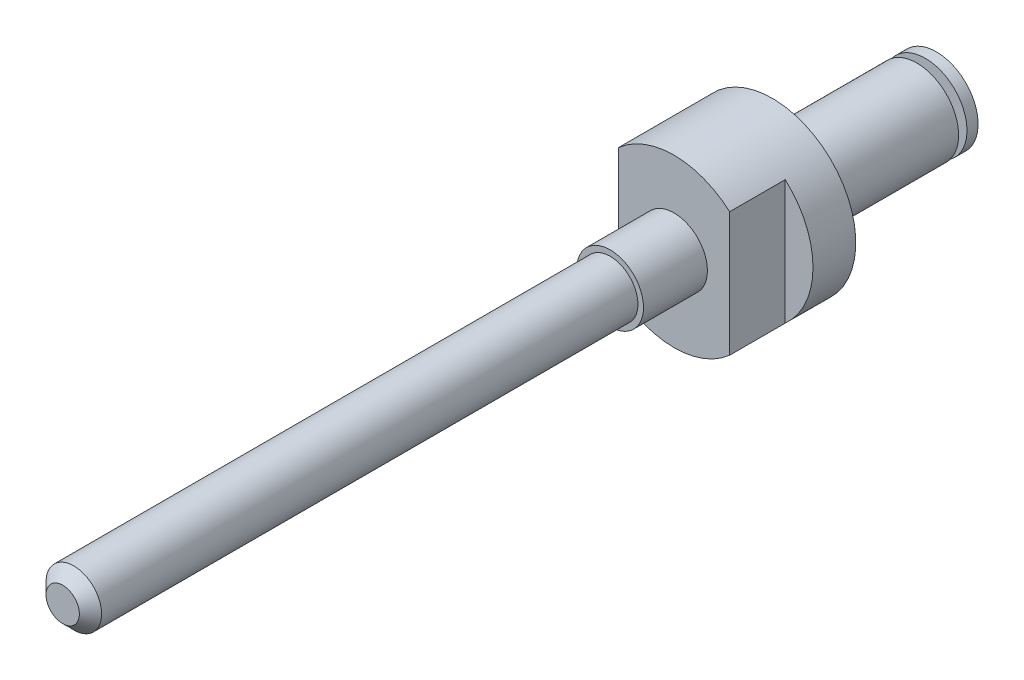
from build123d import *

# Parameters (mm, degrees)
SKETCH2_W           = 1
SKETCH2_H           = 3
CUT_EXTRUDE1_DEPTH  = 1
SKETCH3_R           = 0.6
BOSS_EXTRUDE1_DEPTH = 11
CUT_EXTRUDE2_START  = 1.15
SKETCH4_R           = 0.6
SKETCH4_R_2         = 0.5
CUT_EXTRUDE2_DEPTH  = 11.052678251
CHAMFER1_SIZE       = 0.2


with BuildPart() as part:
    # Sketch1 → Revolve1 (revolve)
    with BuildSketch(Plane(origin=(0, 0, 0), x_dir=(1, 0, 0), z_dir=(0, 1, 0))):
        Polygon((0, 0), (-1.5, 0), (-1.5, 1.77), (-0.75, 1.77), (-0.75, 4.37), (-0.5, 4.37), (-0.5, 4.52), (-0.75, 4.52), (-0.75, 4.72), (0, 4.72), align=None)
    revolve(axis=Axis((0, 0, -4.72), (0, 0, 1)))

    # Sketch2 → Cut-Extrude1 (cut)
    with BuildSketch(Plane.XY):
        with Locations((-1.5, 0)):
            Rectangle(SKETCH2_W, SKETCH2_H)
        with Locations((1.5, 0)):
            Rectangle(SKETCH2_W, SKETCH2_H)
    extrude(amount=-CUT_EXTRUDE1_DEPTH, mode=Mode.SUBTRACT)

    # Sketch3 → Boss-Extrude1 (add)
    with BuildSketch(Plane.XY):
        Circle(SKETCH3_R)
    extrude(amount=BOSS_EXTRUDE1_DEPTH)

    # Sketch4 → Cut-Extrude2 (cut, through all)
    with BuildSketch(Plane.XY.offset(CUT_EXTRUDE2_START)):
        Circle(SKETCH4_R)
        with Locations(Location((0, 0, 0), (0, 0, 180))):
            Circle(SKETCH4_R_2, mode=Mode.SUBTRACT)
    extrude(amount=CUT_EXTRUDE2_DEPTH, mode=Mode.SUBTRACT)

    # Chamfer1
    chamfer1_edges = [part.edges().sort_by_distance(p)[0] for p in [
        (0.5, 0, 11),
    ]]
    chamfer(chamfer1_edges, length=CHAMFER1_SIZE)


solid = part.part
